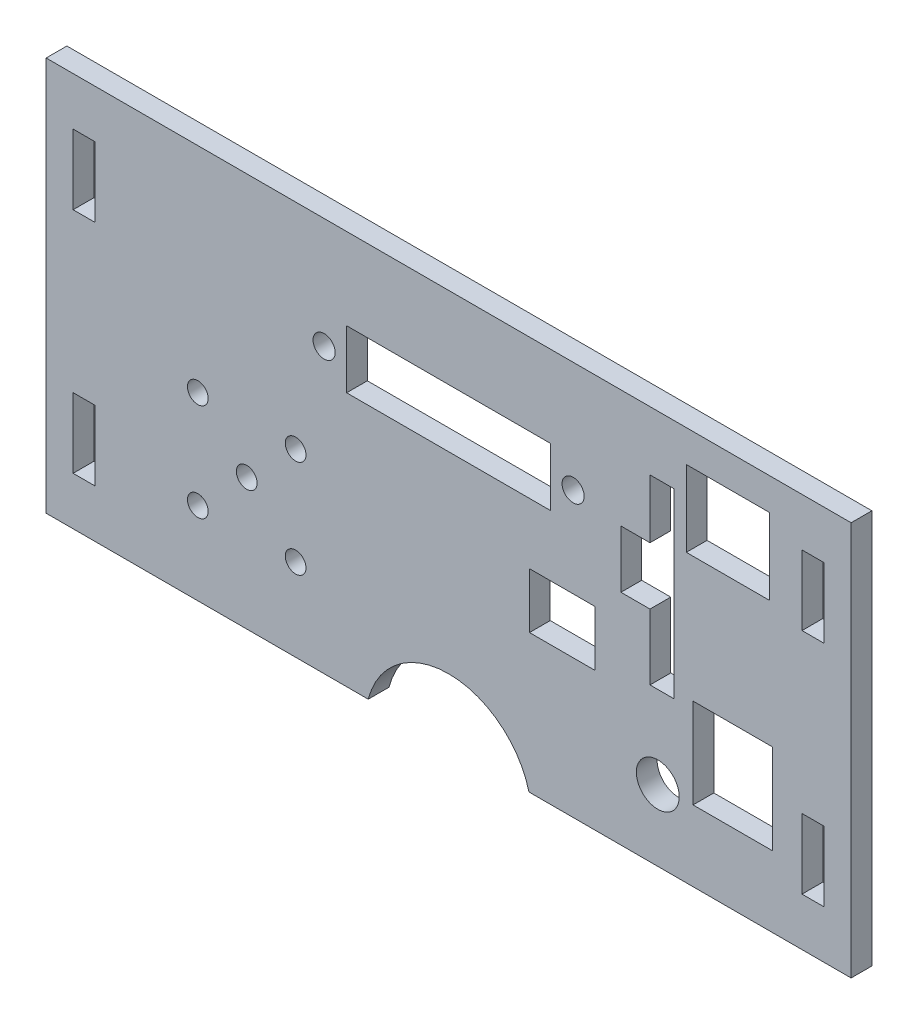
from build123d import *

# Parameters (mm, degrees)
SKETCH1_W                   = 3.2
SKETCH1_H                   = 10.1
BOSS_EXTRUDE1_DEPTH         = 3
SENSOR_MOUNTING_HOLES_REACH = 85.637
SKETCH2_R                   = 1.6
SKETCH2_R_2                 = 1.5
SKETCH2_R_3                 = 3.1
SKETCH2_W                   = 9.5
SKETCH2_H                   = 8
SKETCH2_W_2                 = 29.5
SKETCH2_H_2                 = 8.4
SKETCH2_W_3                 = 11.5
SKETCH2_H_3                 = 13
SKETCH2_W_4                 = 12
SKETCH2_H_4                 = 11


with BuildPart() as part:
    # Sketch1 → Boss-Extrude1 (new body)
    with BuildSketch(Plane.XY):
        with BuildLine():
            Line((-58.19, 60), (58.19, 60))
            Line((58.19, 60), (58.19, 3))
            Line((58.19, 3), (11.618950039, 3))
            ThreePointArc((11.618950039, 3), (0, 12), (-11.618950039, 3))
            Line((-11.618950039, 3), (-58.19, 3))
            Line((-58.19, 3), (-58.19, 60))
        make_face()
        with Locations((-52.69, 15)):
            Rectangle(SKETCH1_W, SKETCH1_H, mode=Mode.SUBTRACT)
        with Locations((-52.69, 48)):
            Rectangle(SKETCH1_W, SKETCH1_H, mode=Mode.SUBTRACT)
        with Locations((52.69, 15)):
            Rectangle(SKETCH1_W, SKETCH1_H, mode=Mode.SUBTRACT)
        with Locations((52.69, 48)):
            Rectangle(SKETCH1_W, SKETCH1_H, mode=Mode.SUBTRACT)
    extrude(amount=-BOSS_EXTRUDE1_DEPTH)

    # Sketch2 (on Front Plane) → sensor mounting holes (cut, up to next)
    with BuildSketch(Plane.XY, mode=Mode.PRIVATE) as sensor_mounting_holes_sk1:
        with Locations((-18, 44)):
            Circle(SKETCH2_R)
    sensor_mounting_holes_tool1 = extrude(sensor_mounting_holes_sk1.sketch, amount=-SENSOR_MOUNTING_HOLES_REACH, mode=Mode.PRIVATE) & part.part
    # Sketch2 (on Front Plane) → sensor mounting holes (cut, up to next)
    with BuildSketch(Plane.XY, mode=Mode.PRIVATE) as sensor_mounting_holes_sk2:
        with Locations((18, 44)):
            Circle(SKETCH2_R)
    sensor_mounting_holes_tool2 = extrude(sensor_mounting_holes_sk2.sketch, amount=-SENSOR_MOUNTING_HOLES_REACH, mode=Mode.PRIVATE) & part.part
    # Sketch2 (on Front Plane) → sensor mounting holes (cut, up to next)
    with BuildSketch(Plane.XY, mode=Mode.PRIVATE) as sensor_mounting_holes_sk3:
        with Locations((-22.118932188, 29.071067812)):
            Circle(SKETCH2_R_2)
    sensor_mounting_holes_tool3 = extrude(sensor_mounting_holes_sk3.sketch, amount=-SENSOR_MOUNTING_HOLES_REACH, mode=Mode.PRIVATE) & part.part
    # Sketch2 (on Front Plane) → sensor mounting holes (cut, up to next)
    with BuildSketch(Plane.XY, mode=Mode.PRIVATE) as sensor_mounting_holes_sk4:
        with Locations((-36.261067812, 29.071067812)):
            Circle(SKETCH2_R_2)
    sensor_mounting_holes_tool4 = extrude(sensor_mounting_holes_sk4.sketch, amount=-SENSOR_MOUNTING_HOLES_REACH, mode=Mode.PRIVATE) & part.part
    # Sketch2 (on Front Plane) → sensor mounting holes (cut, up to next)
    with BuildSketch(Plane.XY, mode=Mode.PRIVATE) as sensor_mounting_holes_sk5:
        with Locations((-36.261067812, 14.928932188)):
            Circle(SKETCH2_R_2)
    sensor_mounting_holes_tool5 = extrude(sensor_mounting_holes_sk5.sketch, amount=-SENSOR_MOUNTING_HOLES_REACH, mode=Mode.PRIVATE) & part.part
    # Sketch2 (on Front Plane) → sensor mounting holes (cut, up to next)
    with BuildSketch(Plane.XY, mode=Mode.PRIVATE) as sensor_mounting_holes_sk6:
        with Locations((-22.118932188, 14.928932188)):
            Circle(SKETCH2_R_2)
    sensor_mounting_holes_tool6 = extrude(sensor_mounting_holes_sk6.sketch, amount=-SENSOR_MOUNTING_HOLES_REACH, mode=Mode.PRIVATE) & part.part
    # Sketch2 (on Front Plane) → sensor mounting holes (cut, up to next)
    with BuildSketch(Plane.XY, mode=Mode.PRIVATE) as sensor_mounting_holes_sk7:
        with Locations((-29.19, 22)):
            Circle(SKETCH2_R_2)
    sensor_mounting_holes_tool7 = extrude(sensor_mounting_holes_sk7.sketch, amount=-SENSOR_MOUNTING_HOLES_REACH, mode=Mode.PRIVATE) & part.part
    # Sketch2 (on Front Plane) → sensor mounting holes (cut, up to next)
    with BuildSketch(Plane.XY, mode=Mode.PRIVATE) as sensor_mounting_holes_sk8:
        with Locations((30.240588995, 13.245945843)):
            Circle(SKETCH2_R_3)
    sensor_mounting_holes_tool8 = extrude(sensor_mounting_holes_sk8.sketch, amount=-SENSOR_MOUNTING_HOLES_REACH, mode=Mode.PRIVATE) & part.part
    # Sketch2 (on Front Plane) → sensor mounting holes (cut, up to next)
    with BuildSketch(Plane.XY, mode=Mode.PRIVATE) as sensor_mounting_holes_sk9:
        with Locations((16.44, 27)):
            Rectangle(SKETCH2_W, SKETCH2_H)
    sensor_mounting_holes_tool9 = extrude(sensor_mounting_holes_sk9.sketch, amount=-SENSOR_MOUNTING_HOLES_REACH, mode=Mode.PRIVATE) & part.part
    # Sketch2 (on Front Plane) → sensor mounting holes (cut, up to next)
    with BuildSketch(Plane.XY, mode=Mode.PRIVATE) as sensor_mounting_holes_sk10:
        with Locations((0, 44)):
            Rectangle(SKETCH2_W_2, SKETCH2_H_2)
    sensor_mounting_holes_tool10 = extrude(sensor_mounting_holes_sk10.sketch, amount=-SENSOR_MOUNTING_HOLES_REACH, mode=Mode.PRIVATE) & part.part
    # Sketch2 (on Front Plane) → sensor mounting holes (cut, up to next)
    with BuildSketch(Plane.XY, mode=Mode.PRIVATE) as sensor_mounting_holes_sk11:
        Polygon((24.912246381, 42.955051143), (29.112246381, 42.955051143), (29.112246381, 51.455051143), (32.612246381, 51.455051143), (32.612246381, 25.155051143), (29.112246381, 25.155051143), (29.112246381, 34.655051143), (24.912246381, 34.655051143), align=None)
    sensor_mounting_holes_tool11 = extrude(sensor_mounting_holes_sk11.sketch, amount=-SENSOR_MOUNTING_HOLES_REACH, mode=Mode.PRIVATE) & part.part
    # Sketch2 (on Front Plane) → sensor mounting holes (cut, up to next)
    with BuildSketch(Plane.XY, mode=Mode.PRIVATE) as sensor_mounting_holes_sk12:
        with Locations((41.090588995, 19.745945843)):
            Rectangle(SKETCH2_W_3, SKETCH2_H_3)
    sensor_mounting_holes_tool12 = extrude(sensor_mounting_holes_sk12.sketch, amount=-SENSOR_MOUNTING_HOLES_REACH, mode=Mode.PRIVATE) & part.part
    # Sketch2 (on Front Plane) → sensor mounting holes (cut, up to next)
    with BuildSketch(Plane.XY, mode=Mode.PRIVATE) as sensor_mounting_holes_sk13:
        with Locations((40.362246381, 49.88070744)):
            Rectangle(SKETCH2_W_4, SKETCH2_H_4)
    sensor_mounting_holes_tool13 = extrude(sensor_mounting_holes_sk13.sketch, amount=-SENSOR_MOUNTING_HOLES_REACH, mode=Mode.PRIVATE) & part.part
    add(sensor_mounting_holes_tool1.solids().sort_by_distance((-18, 44, 0))[0], mode=Mode.SUBTRACT)
    add(sensor_mounting_holes_tool2.solids().sort_by_distance((18, 44, 0))[0], mode=Mode.SUBTRACT)
    add(sensor_mounting_holes_tool3.solids().sort_by_distance((-22.118932, 29.071068, 0))[0], mode=Mode.SUBTRACT)
    add(sensor_mounting_holes_tool4.solids().sort_by_distance((-36.261068, 29.071068, 0))[0], mode=Mode.SUBTRACT)
    add(sensor_mounting_holes_tool5.solids().sort_by_distance((-36.261068, 14.928932, 0))[0], mode=Mode.SUBTRACT)
    add(sensor_mounting_holes_tool6.solids().sort_by_distance((-22.118932, 14.928932, 0))[0], mode=Mode.SUBTRACT)
    add(sensor_mounting_holes_tool7.solids().sort_by_distance((-29.19, 22, 0))[0], mode=Mode.SUBTRACT)
    add(sensor_mounting_holes_tool8.solids().sort_by_distance((30.240589, 13.245946, 0))[0], mode=Mode.SUBTRACT)
    add(sensor_mounting_holes_tool9.solids().sort_by_distance((16.44, 27, 0))[0], mode=Mode.SUBTRACT)
    add(sensor_mounting_holes_tool10.solids().sort_by_distance((0, 44, 0))[0], mode=Mode.SUBTRACT)
    add(sensor_mounting_holes_tool11.solids().sort_by_distance((29.804717, 38.442393, 0))[0], mode=Mode.SUBTRACT)
    add(sensor_mounting_holes_tool12.solids().sort_by_distance((41.090589, 19.745946, 0))[0], mode=Mode.SUBTRACT)
    add(sensor_mounting_holes_tool13.solids().sort_by_distance((40.362246, 49.880707, 0))[0], mode=Mode.SUBTRACT)


solid = part.part
